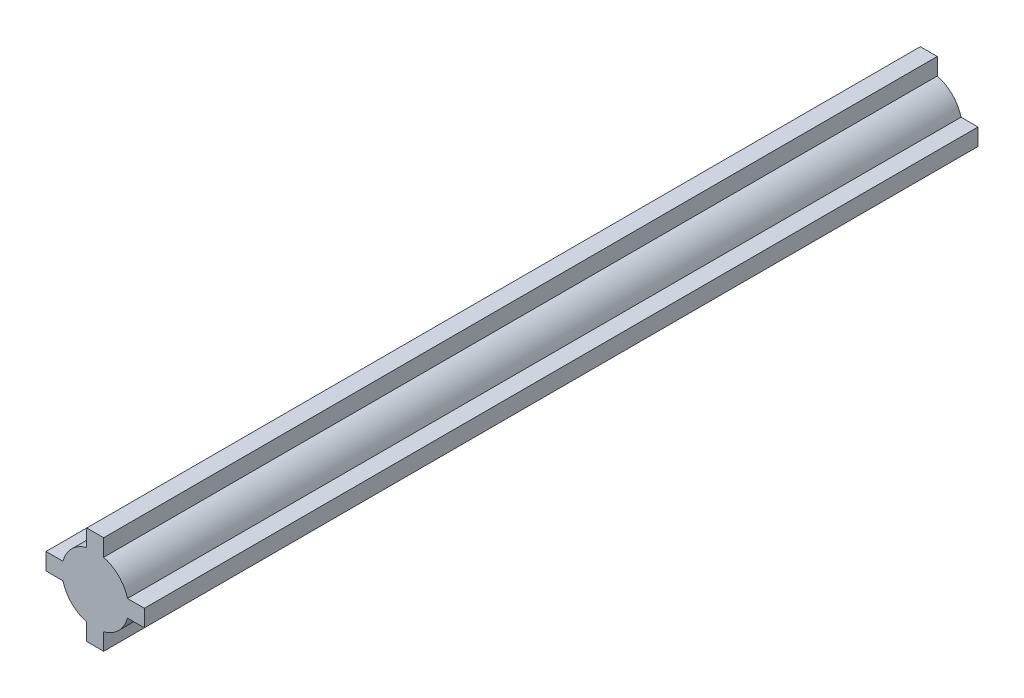
from build123d import *

# Parameters (mm, degrees)
SKETCH1_R           = 1
SKETCH1_W           = 0.508
SKETCH1_H           = 0.508
BOSS_EXTRUDE1_DEPTH = 12.5


with BuildPart() as part:
    # Sketch1 → Boss-Extrude1 (new, symmetric)
    with BuildSketch(Plane.XY):
        Circle(SKETCH1_R)
        with Locations((0, 1.221204218)):
            Rectangle(SKETCH1_W, SKETCH1_H)
        with Locations((0, -1.221204218)):
            Rectangle(SKETCH1_W, SKETCH1_H)
        with Locations((1.221204218, 0)):
            Rectangle(SKETCH1_W, SKETCH1_H)
        with Locations((-1.221204218, 0)):
            Rectangle(SKETCH1_W, SKETCH1_H)
    extrude(amount=BOSS_EXTRUDE1_DEPTH, both=True)


solid = part.part
